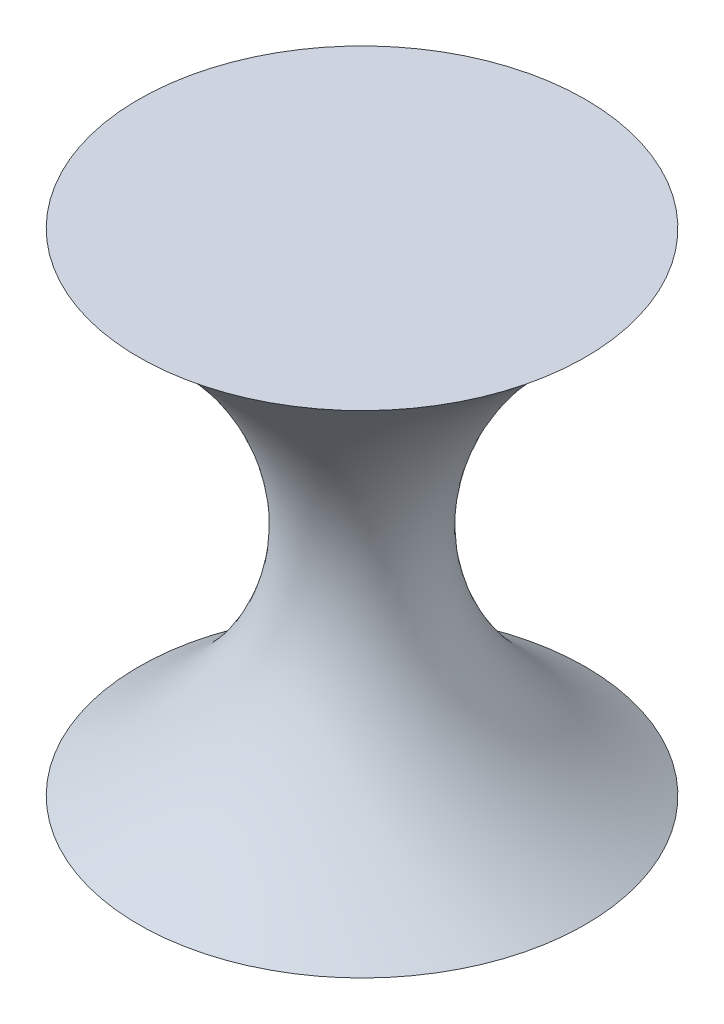
from build123d import *


with BuildPart() as part:
    # Sketch1 → Revolve1 (revolve)
    with BuildSketch(Plane.XY):
        with BuildLine():
            Line((30, 34), (0, 34))
            Line((0, 34), (0, 100))
            Line((0, 100), (30, 100))
            add(Edge.make_bspline(
                [(30, 100), (1.69336868, 77.693405339), (1.830971878, 52.259662817), (30, 34)],
                knots=[0, 0, 0, 0, 1, 1, 1, 1], degree=3))
        make_face()
    revolve(axis=Axis((0, 0, 0), (0, 1, 0)))


solid = part.part
